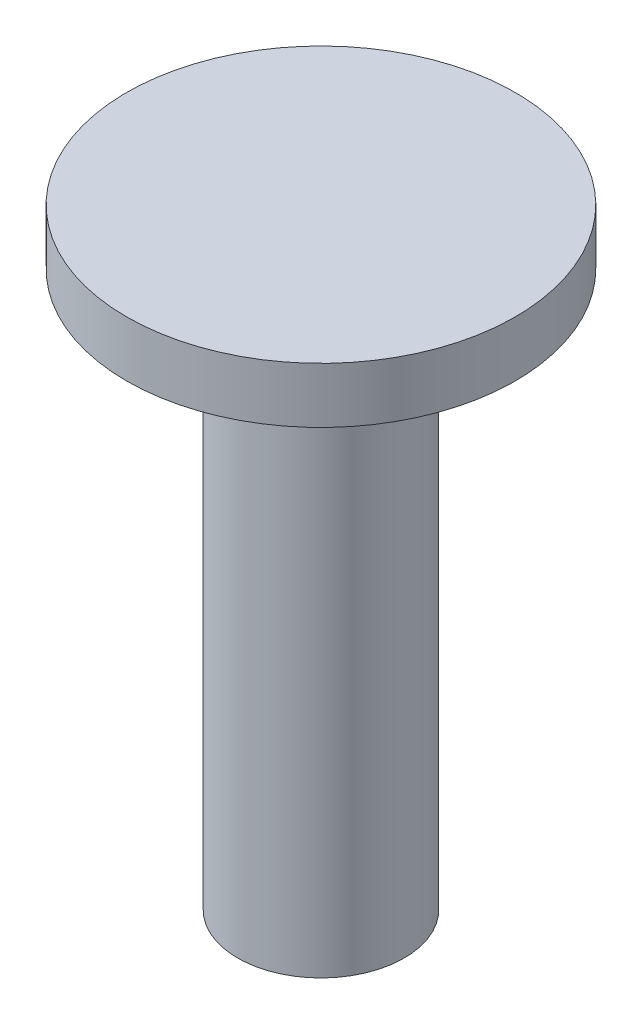
from build123d import *

# Parameters (mm, degrees)
SKETCH_1_R      = 3.5
EXTRUDE_1_DEPTH = 1
SKETCH_2_R      = 1.5
EXTRUDE_2_DEPTH = 10


with BuildPart() as part:
    # 草图1 → 凸台-拉伸1 (new body)
    with BuildSketch(Plane(origin=(0, 0, 0), x_dir=(1, 0, 0), z_dir=(0, 1, 0))):
        with Locations(Location((0, 0, 0), (0, 0, 270))):
            Circle(SKETCH_1_R)
    extrude(amount=EXTRUDE_1_DEPTH)

    # 草图2 → 凸台-拉伸2 (add)
    with BuildSketch(Plane.XZ):
        with Locations(Location((0, 0, 0), (0, 0, 270))):
            Circle(SKETCH_2_R)
    extrude(amount=EXTRUDE_2_DEPTH)


solid = part.part
